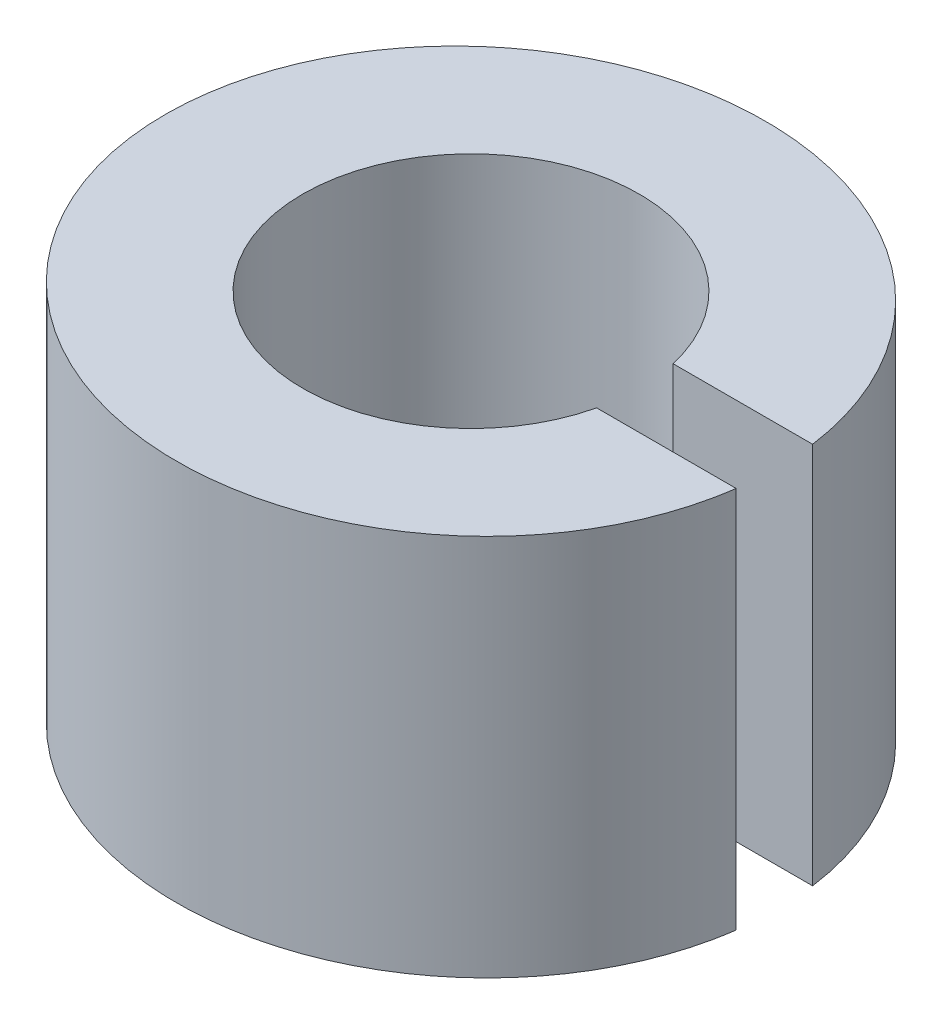
from build123d import *

# Parameters (mm, degrees)
BOSS_EXTRUDE1_DEPTH = 6.35


with BuildPart() as part:
    # Sketch1 → Boss-Extrude1 (new body)
    with BuildSketch(Plane(origin=(0, 0, 0), x_dir=(1, 0, 0), z_dir=(0, 1, 0))):
        with BuildLine():
            ThreePointArc((2.720884231, -0.635), (-2.794, 0), (2.720884231, 0.635))
            Line((2.720884231, 0.635), (5.036977545, 0.635))
            add(Edge.make_bspline(
                [(5.036977545, 0.635), (4.458014602, 4.889500049), (-5.8e-08, 4.8895)],
                knots=[3.271830653, 3.271830653, 3.271830653, 4.712388992, 4.712388992, 4.712388992], degree=2, weights=[1, 0.75162162, 1]))
            add(Edge.make_bspline(
                [(-5.8e-08, 4.8895), (-5.08, 4.889499944), (-5.08, 0)],
                knots=[4.712388992, 4.712388992, 4.712388992, 6.283185307, 6.283185307, 6.283185307], degree=2, weights=[1, 0.707106785, 1]))
            add(Edge.make_bspline(
                [(-5.08, 0), (-5.08, -4.889499993), (-7e-09, -4.8895)],
                knots=[0, 0, 0, 1.570796325, 1.570796325, 1.570796325], degree=2, weights=[1, 0.707106782, 1]))
            add(Edge.make_bspline(
                [(-7e-09, -4.8895), (4.458014608, -4.889500006), (5.036977545, -0.635)],
                knots=[1.570796325, 1.570796325, 1.570796325, 3.011354654, 3.011354654, 3.011354654], degree=2, weights=[1, 0.751621623, 1]))
            Line((5.036977545, -0.635), (2.720884231, -0.635))
        make_face()
    extrude(amount=BOSS_EXTRUDE1_DEPTH)


solid = part.part
